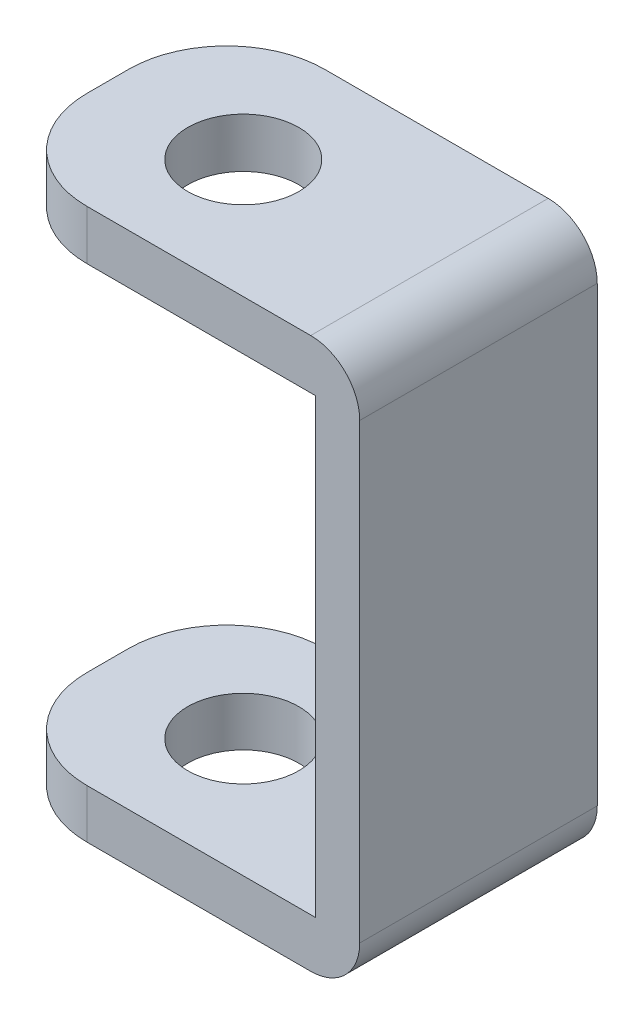
from build123d import *

# Parameters (mm, degrees)
SKETCH2_R           = 7.93
BOSS_EXTRUDE1_DEPTH = 78.59
FILLET1_R           = 7
CUT_EXTRUDE1_DEPTH  = 86.59
FILLET2_R           = 7


with BuildPart() as part:
    # Sketch2 → Boss-Extrude1 (new body)
    with BuildSketch(Plane(origin=(0, 0, 0), x_dir=(1, 0, 0), z_dir=(0, 1, 0))):
        with BuildLine():
            Line((-0.121305042, 14), (-0.121305042, 19.9))
            ThreePointArc((-0.121305042, 19.9), (3.979200021, 29.799494937), (13.878694958, 33.9))
            Line((13.878694958, 33.9), (52.778694958, 33.9))
            Line((52.778694958, 33.9), (52.778694958, 0))
            Line((52.778694958, 0), (13.878694958, 0))
            ThreePointArc((13.878694958, 0), (3.979200021, 4.100505063), (-0.121305042, 14))
        make_face()
        with Locations(Location((19.205687065, 16.95, 0), (0, 0, 270))):
            Circle(SKETCH2_R, mode=Mode.SUBTRACT)
    extrude(amount=BOSS_EXTRUDE1_DEPTH)

    # Fillet1
    fillet1_edges = [part.edges().sort_by_distance(p)[0] for p in [
        (52.778694958, 78.59, -16.95),
    ]]
    fillet(fillet1_edges, radius=FILLET1_R)

    # Sketch8 → Cut-Extrude1 (cut)
    with BuildSketch(Plane.XY):
        Polygon((46.445498075, 69.59), (46.445498075, 7), (13.878694958, 7), (-13.306366157, 7), (-13.306366157, 69.59), (-13.306366157, 71.500154521), (13.878694958, 71.500154521), (46.445498075, 71.500154521), align=None)
    extrude(amount=-CUT_EXTRUDE1_DEPTH, mode=Mode.SUBTRACT)

    # Fillet2
    fillet2_edges = [part.edges().sort_by_distance(p)[0] for p in [
        (52.778694958, 0, -16.95),
    ]]
    fillet(fillet2_edges, radius=FILLET2_R)


solid = part.part
